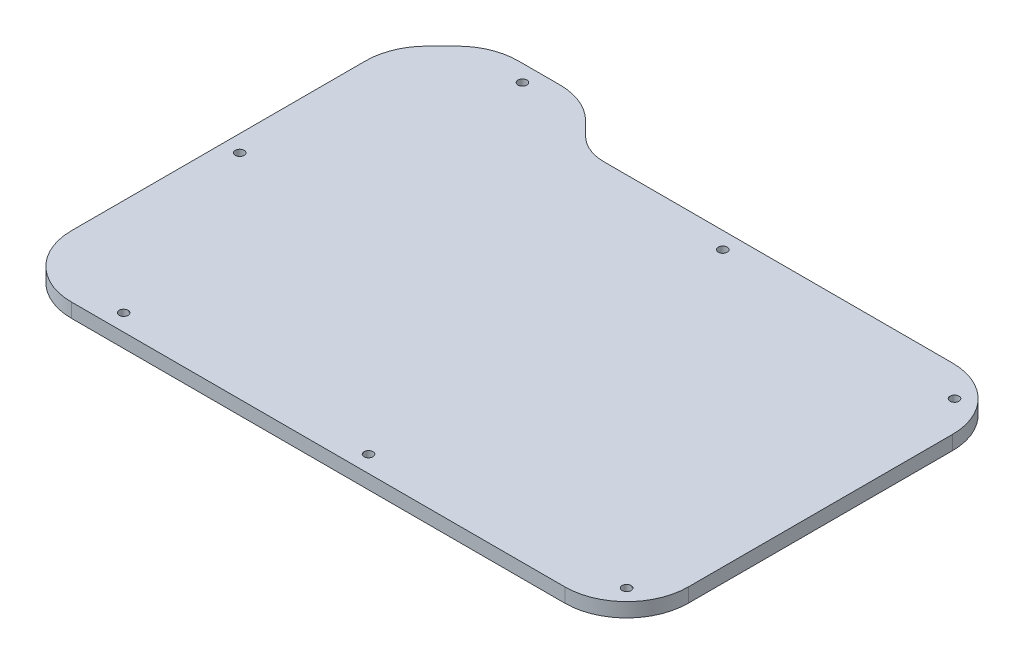
from build123d import *

# Parameters (mm, degrees)
SKETCH1_R           = 1
BOSS_EXTRUDE1_DEPTH = 3.175


with BuildPart() as part:
    # Sketch1 → Boss-Extrude1 (new body)
    with BuildSketch(Plane(origin=(0, 0, 0), x_dir=(1, 0, 0), z_dir=(0, 1, 0))):
        with BuildLine():
            Line((-268.253734697, -101.056878234), (-268.253734697, -167.076622113))
            ThreePointArc((-268.253734697, -167.076622113), (-264.197163616, -176.870051033), (-254.403734697, -180.926622113))
            Line((-254.403734697, -180.926622113), (-143.66889433, -180.926622113))
            ThreePointArc((-143.66889433, -180.926622113), (-133.87546541, -176.870051033), (-129.81889433, -167.076622113))
            Line((-129.81889433, -167.076622113), (-129.81889433, -107.776622113))
            ThreePointArc((-129.81889433, -107.776622113), (-133.87546541, -97.983193194), (-143.66889433, -93.926622113))
            Line((-143.66889433, -93.926622113), (-221.881483076, -93.926622113))
            ThreePointArc((-221.881483076, -93.926622113), (-225.7083174, -93.165417438), (-228.952550888, -90.997689925))
            Line((-228.952550888, -90.997689925), (-231.967047619, -87.983193194))
            ThreePointArc((-231.967047619, -87.983193194), (-236.460311001, -84.980890588), (-241.760476539, -83.926622113))
            Line((-241.760476539, -83.926622113), (-251.123478576, -83.926622113))
            ThreePointArc((-251.123478576, -83.926622113), (-256.423644114, -84.980890588), (-260.916907495, -87.983193194))
            Line((-260.916907495, -87.983193194), (-264.197163616, -91.263449315))
            ThreePointArc((-264.197163616, -91.263449315), (-267.199466222, -95.756712696), (-268.253734697, -101.056878234))
        make_face()
        with Locations(Location((-246.441977557, -177.176622113, 0), (0, 0, 270))):
            Circle(SKETCH1_R, mode=Mode.SUBTRACT)
        with Locations(Location((-264.503734697, -133.066750174, 0), (0, 0, 270))):
            Circle(SKETCH1_R, mode=Mode.SUBTRACT)
        with Locations(Location((-246.441977557, -87.676622113, 0), (0, 0, 270))):
            Circle(SKETCH1_R, mode=Mode.SUBTRACT)
        with Locations(Location((-191.484546698, -97.676622113, 0), (0, 0, 270))):
            Circle(SKETCH1_R, mode=Mode.SUBTRACT)
        with Locations(Location((-136.52711584, -100.634843623, 0), (0, 0, 270))):
            Circle(SKETCH1_R, mode=Mode.SUBTRACT)
        with Locations(Location((-136.52711584, -174.218400603, 0), (0, 0, 270))):
            Circle(SKETCH1_R, mode=Mode.SUBTRACT)
        with Locations(Location((-191.484546698, -177.176622113, 0), (0, 0, 270))):
            Circle(SKETCH1_R, mode=Mode.SUBTRACT)
    extrude(amount=BOSS_EXTRUDE1_DEPTH)


solid = part.part
